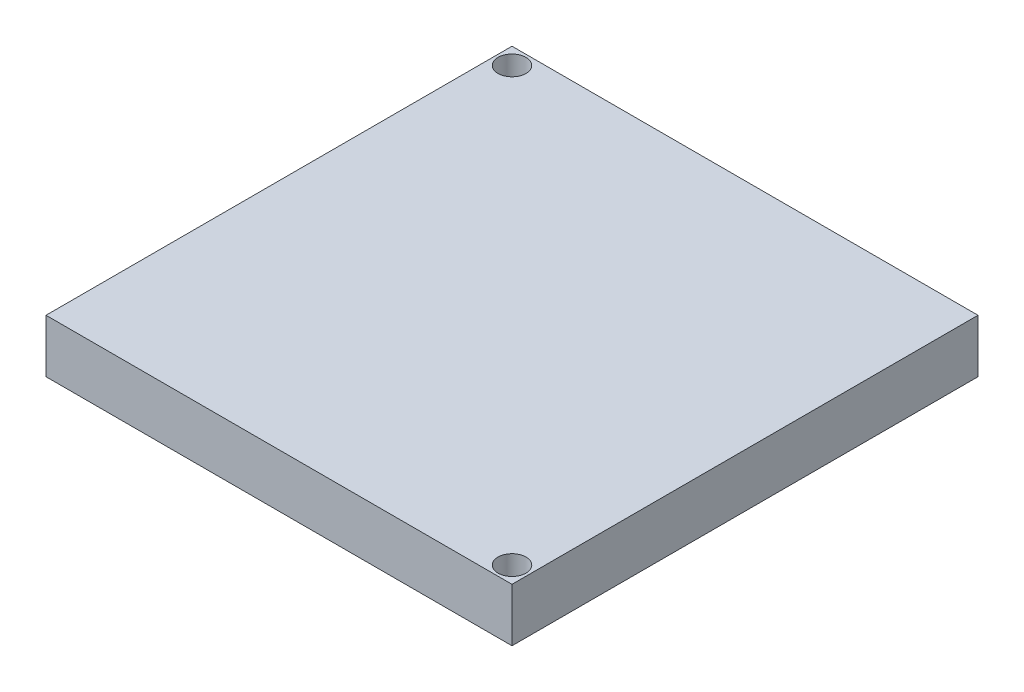
from build123d import *

# Parameters (mm, degrees)
SKETCH_1_W          = 70
SKETCH_1_H          = 70
EXTRUDE_1_DEPTH     = 8
SKETCH_2_R          = 2.1
CUT_EXTRUDE_1_DEPTH = 8


with BuildPart() as part:
    # 草图1 → 凸台-拉伸1 (new body)
    with BuildSketch(Plane(origin=(0, 0, 0), x_dir=(1, 0, 0), z_dir=(0, 1, 0))):
        Rectangle(SKETCH_1_W, SKETCH_1_H)
    extrude(amount=EXTRUDE_1_DEPTH)

    # 草图2 → 切除-拉伸1 (cut)
    with BuildSketch(Plane(origin=(0, 8, 0), x_dir=(1, 0, 0), z_dir=(0, 1, 0))):
        with Locations(Location((-32.5, 32.5, 0), (0, 0, 270))):
            Circle(SKETCH_2_R)
        with Locations(Location((32.5, -32.5, 0), (0, 0, 270))):
            Circle(SKETCH_2_R)
    extrude(amount=-CUT_EXTRUDE_1_DEPTH, mode=Mode.SUBTRACT)


solid = part.part
